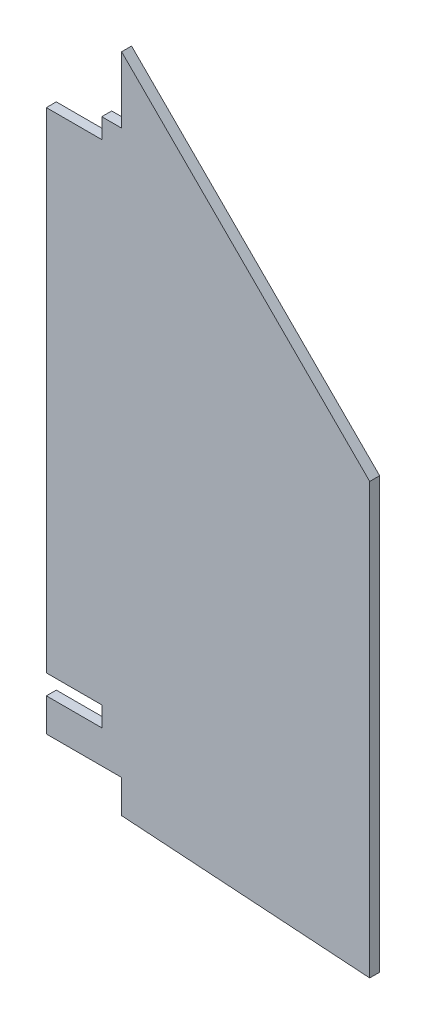
from build123d import *

# Parameters (mm, degrees)
BOSS_EXTRUDE2_DEPTH = 3


with BuildPart() as part:
    # Sketch2 → Boss-Extrude2 (new body)
    with BuildSketch(Plane.XY):
        Polygon((-119.948186528, 12.694300518), (-119.948186528, 22.694300518), (-142.698186528, 22.694300518), (-142.698186528, 32.694300518), (-125.948186528, 32.694300518), (-125.948186528, 38.694300518), (-142.698186528, 38.694300518), (-142.698186528, 186.694300518), (-125.948186528, 186.694300518), (-125.948186528, 192.694300518), (-119.948186528, 192.694300518), (-119.948186528, 212.694300518), (-44.948186528, 137.694300518), (-44.948186528, 7.694300518), align=None)
    extrude(amount=BOSS_EXTRUDE2_DEPTH)


solid = part.part
